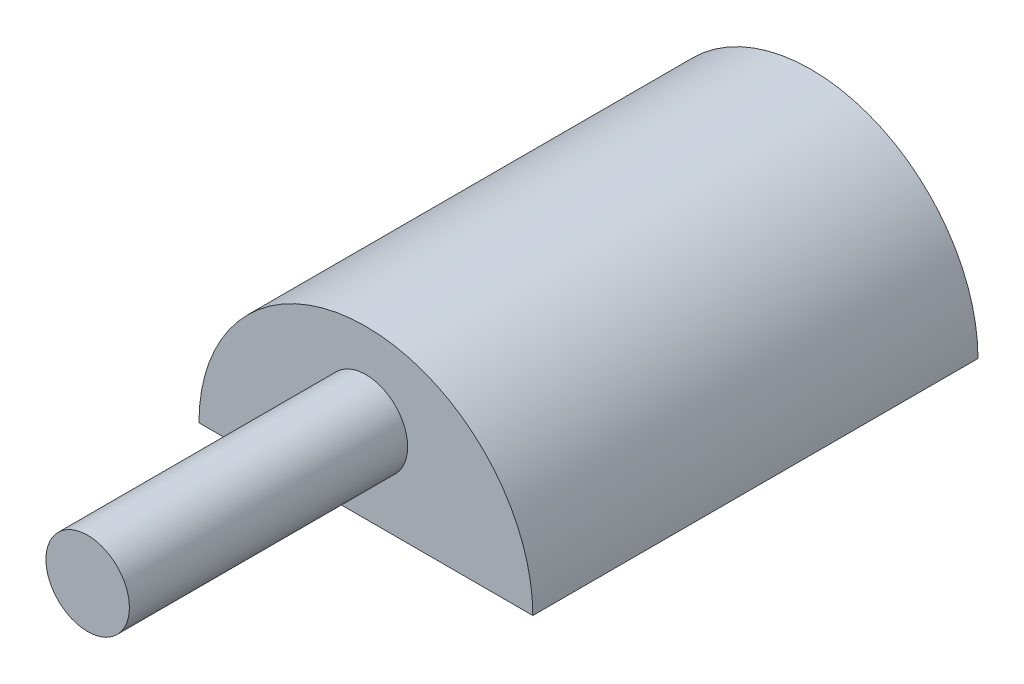
from build123d import *

# Parameters (mm, degrees)
SALIENTE_EXTRUIR1_DEPTH = 203.2
CROQUIS2_R              = 19.05
SALIENTE_EXTRUIR2_DEPTH = 127


with BuildPart() as part:
    # Croquis1 → Saliente-Extruir1 (new body)
    with BuildSketch(Plane.XY):
        with BuildLine():
            Line((0, 0), (76.2, 0))
            ThreePointArc((76.2, 0), (0, 76.2), (-76.2, 0))
            Line((-76.2, 0), (0, 0))
        make_face()
    extrude(amount=SALIENTE_EXTRUIR1_DEPTH)

    # Croquis2 → Saliente-Extruir2 (add)
    with BuildSketch(Plane.XY.offset(203.2)):
        with Locations((0, 38.1)):
            Circle(CROQUIS2_R)
    extrude(amount=SALIENTE_EXTRUIR2_DEPTH)


solid = part.part
